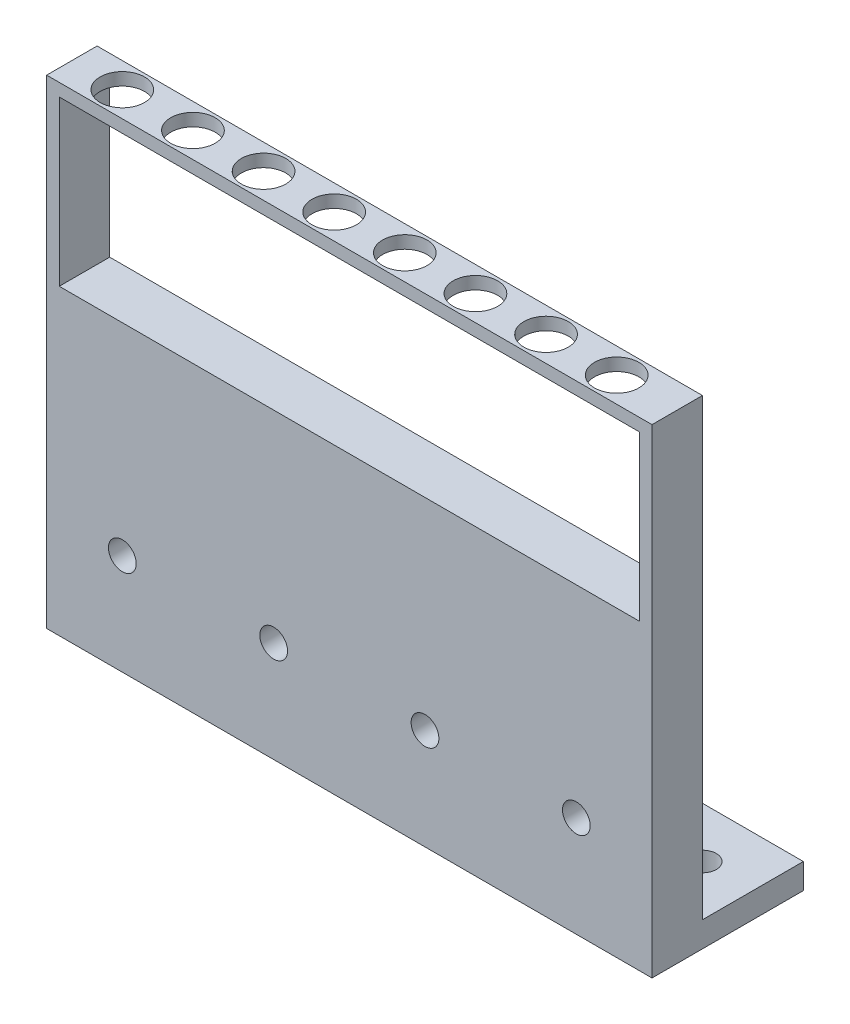
from build123d import *

# Parameters (mm, degrees)
SKETCH1_W           = 152.4
SKETCH1_H           = 12.7
BOSS_EXTRUDE1_DEPTH = 76.2
SKETCH2_R           = 3.4925
BOSS_EXTRUDE4_DEPTH = 6.35
BOSS_EXTRUDE5_DEPTH = 12.7
CUT_EXTRUDE1_REACH  = 148.188
SKETCH4_R           = 5.588
SKETCH5_R           = 3.4925
CUT_EXTRUDE2_DEPTH  = 145.941445074


with BuildPart() as part:
    # Sketch1 → Boss-Extrude1 (new body)
    with BuildSketch(Plane(origin=(0, 0, 0), x_dir=(1, 0, 0), z_dir=(0, 1, 0))):
        Rectangle(SKETCH1_W, SKETCH1_H)
    extrude(amount=BOSS_EXTRUDE1_DEPTH)

    # Sketch2 → Boss-Extrude4 (add)
    with BuildSketch(Plane(origin=(0, 0, 0), x_dir=(1, 0, 0), z_dir=(0, 1, 0))):
        Polygon((-76.2, 19.05), (-76.2, 6.35), (76.2, 6.35), (76.2, 31.75), (-76.2, 31.75), align=None)
        with Locations(Location((-63.5, 19.05, 0), (0, 0, 270))):
            Circle(SKETCH2_R, mode=Mode.SUBTRACT)
        with Locations(Location((-38.1, 19.05, 0), (0, 0, 270))):
            Circle(SKETCH2_R, mode=Mode.SUBTRACT)
        with Locations(Location((-12.7, 19.05, 0), (0, 0, 270))):
            Circle(SKETCH2_R, mode=Mode.SUBTRACT)
        with Locations(Location((12.7, 19.05, 0), (0, 0, 270))):
            Circle(SKETCH2_R, mode=Mode.SUBTRACT)
        with Locations(Location((38.1, 19.05, 0), (0, 0, 270))):
            Circle(SKETCH2_R, mode=Mode.SUBTRACT)
        with Locations(Location((63.5, 19.05, 0), (0, 0, 270))):
            Circle(SKETCH2_R, mode=Mode.SUBTRACT)
    extrude(amount=BOSS_EXTRUDE4_DEPTH)

    # Sketch3 → Boss-Extrude5 (add)
    with BuildSketch(Plane.XY.offset(6.35)):
        Polygon((-76.2, 76.2), (-76.2, 120.65), (76.2, 120.65), (76.2, 76.2), (73.025, 76.2), (73.025, 117.475), (-73.025, 117.475), (-73.025, 76.2), align=None)
    extrude(amount=-BOSS_EXTRUDE5_DEPTH)

    # Sketch4 → Cut-Extrude1 (cut, up to next)
    with BuildSketch(Plane(origin=(0, 120.65, 0), x_dir=(1, 0, 0), z_dir=(0, 1, 0)), mode=Mode.PRIVATE) as cut_extrude1_sk1:
        with Locations(Location((-63.5, 0, 0), (0, 0, 270))):
            Circle(SKETCH4_R)
    cut_extrude1_tool1 = extrude(cut_extrude1_sk1.sketch, amount=-CUT_EXTRUDE1_REACH, mode=Mode.PRIVATE) & part.part
    # Sketch4 → Cut-Extrude1 (cut, up to next)
    with BuildSketch(Plane(origin=(0, 120.65, 0), x_dir=(1, 0, 0), z_dir=(0, 1, 0)), mode=Mode.PRIVATE) as cut_extrude1_sk2:
        with Locations(Location((-45.72, 0, 0), (0, 0, 270))):
            Circle(SKETCH4_R)
    cut_extrude1_tool2 = extrude(cut_extrude1_sk2.sketch, amount=-CUT_EXTRUDE1_REACH, mode=Mode.PRIVATE) & part.part
    # Sketch4 → Cut-Extrude1 (cut, up to next)
    with BuildSketch(Plane(origin=(0, 120.65, 0), x_dir=(1, 0, 0), z_dir=(0, 1, 0)), mode=Mode.PRIVATE) as cut_extrude1_sk3:
        with Locations(Location((-27.94, 0, 0), (0, 0, 270))):
            Circle(SKETCH4_R)
    cut_extrude1_tool3 = extrude(cut_extrude1_sk3.sketch, amount=-CUT_EXTRUDE1_REACH, mode=Mode.PRIVATE) & part.part
    # Sketch4 → Cut-Extrude1 (cut, up to next)
    with BuildSketch(Plane(origin=(0, 120.65, 0), x_dir=(1, 0, 0), z_dir=(0, 1, 0)), mode=Mode.PRIVATE) as cut_extrude1_sk4:
        with Locations(Location((-10.16, 0, 0), (0, 0, 270))):
            Circle(SKETCH4_R)
    cut_extrude1_tool4 = extrude(cut_extrude1_sk4.sketch, amount=-CUT_EXTRUDE1_REACH, mode=Mode.PRIVATE) & part.part
    # Sketch4 → Cut-Extrude1 (cut, up to next)
    with BuildSketch(Plane(origin=(0, 120.65, 0), x_dir=(1, 0, 0), z_dir=(0, 1, 0)), mode=Mode.PRIVATE) as cut_extrude1_sk5:
        with Locations(Location((7.62, 0, 0), (0, 0, 270))):
            Circle(SKETCH4_R)
    cut_extrude1_tool5 = extrude(cut_extrude1_sk5.sketch, amount=-CUT_EXTRUDE1_REACH, mode=Mode.PRIVATE) & part.part
    # Sketch4 → Cut-Extrude1 (cut, up to next)
    with BuildSketch(Plane(origin=(0, 120.65, 0), x_dir=(1, 0, 0), z_dir=(0, 1, 0)), mode=Mode.PRIVATE) as cut_extrude1_sk6:
        with Locations(Location((25.4, 0, 0), (0, 0, 270))):
            Circle(SKETCH4_R)
    cut_extrude1_tool6 = extrude(cut_extrude1_sk6.sketch, amount=-CUT_EXTRUDE1_REACH, mode=Mode.PRIVATE) & part.part
    # Sketch4 → Cut-Extrude1 (cut, up to next)
    with BuildSketch(Plane(origin=(0, 120.65, 0), x_dir=(1, 0, 0), z_dir=(0, 1, 0)), mode=Mode.PRIVATE) as cut_extrude1_sk7:
        with Locations(Location((43.18, 0, 0), (0, 0, 270))):
            Circle(SKETCH4_R)
    cut_extrude1_tool7 = extrude(cut_extrude1_sk7.sketch, amount=-CUT_EXTRUDE1_REACH, mode=Mode.PRIVATE) & part.part
    # Sketch4 → Cut-Extrude1 (cut, up to next)
    with BuildSketch(Plane(origin=(0, 120.65, 0), x_dir=(1, 0, 0), z_dir=(0, 1, 0)), mode=Mode.PRIVATE) as cut_extrude1_sk8:
        with Locations(Location((60.96, 0, 0), (0, 0, 270))):
            Circle(SKETCH4_R)
    cut_extrude1_tool8 = extrude(cut_extrude1_sk8.sketch, amount=-CUT_EXTRUDE1_REACH, mode=Mode.PRIVATE) & part.part
    add(cut_extrude1_tool1.solids().sort_by_distance((-63.5, 120.65, 0))[0], mode=Mode.SUBTRACT)
    add(cut_extrude1_tool2.solids().sort_by_distance((-45.72, 120.65, 0))[0], mode=Mode.SUBTRACT)
    add(cut_extrude1_tool3.solids().sort_by_distance((-27.94, 120.65, 0))[0], mode=Mode.SUBTRACT)
    add(cut_extrude1_tool4.solids().sort_by_distance((-10.16, 120.65, 0))[0], mode=Mode.SUBTRACT)
    add(cut_extrude1_tool5.solids().sort_by_distance((7.62, 120.65, 0))[0], mode=Mode.SUBTRACT)
    add(cut_extrude1_tool6.solids().sort_by_distance((25.4, 120.65, 0))[0], mode=Mode.SUBTRACT)
    add(cut_extrude1_tool7.solids().sort_by_distance((43.18, 120.65, 0))[0], mode=Mode.SUBTRACT)
    add(cut_extrude1_tool8.solids().sort_by_distance((60.96, 120.65, 0))[0], mode=Mode.SUBTRACT)

    # Sketch5 → Cut-Extrude2 (cut, through all)
    with BuildSketch(Plane(origin=(0, 0, -6.35), x_dir=(-1, 0, 0), z_dir=(0, 0, -1))):
        with Locations((-57.15, 25.4)):
            Circle(SKETCH5_R)
        with Locations((-19.05, 25.4)):
            Circle(SKETCH5_R)
        with Locations((19.05, 25.4)):
            Circle(SKETCH5_R)
        with Locations((57.15, 25.4)):
            Circle(SKETCH5_R)
    extrude(amount=-CUT_EXTRUDE2_DEPTH, mode=Mode.SUBTRACT)


solid = part.part
